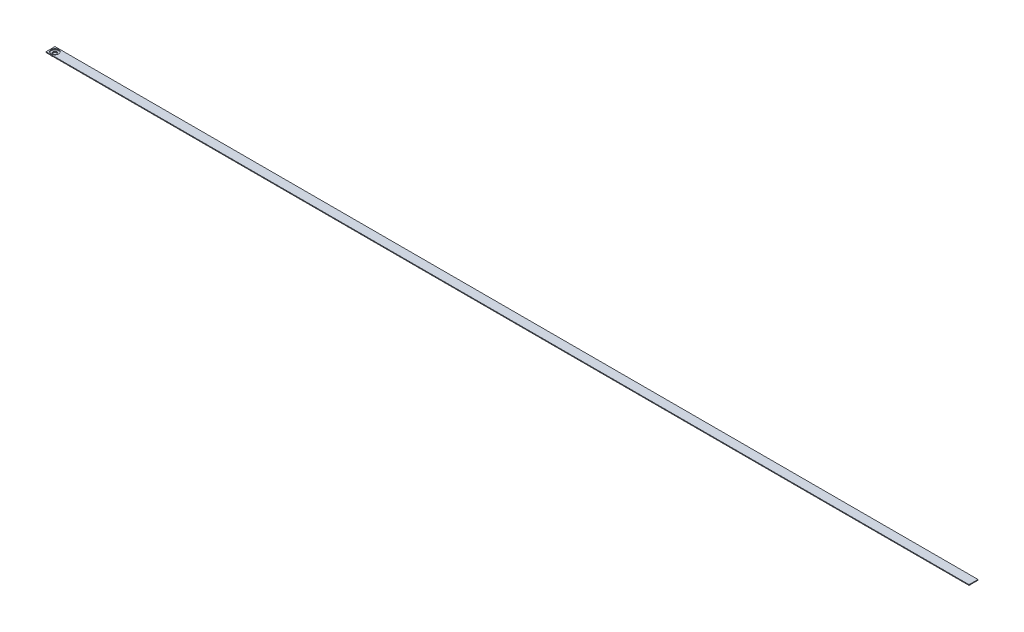
from build123d import *

# Parameters (mm, degrees)
SKETCH1_W           = 2450
SKETCH1_H           = 23.8
BOSS_EXTRUDE1_DEPTH = 0.95
CUT_EXTRUDE1_REACH  = 1227.059
SKETCH3_R           = 10
SKETCH4_R           = 10
SKETCH4_R_2         = 5.25
BOSS_EXTRUDE3_DEPTH = 0.95
SKETCH5_R           = 5.25
BOSS_EXTRUDE4_DEPTH = 0.95


with BuildPart() as part:
    # Sketch1 → Boss-Extrude1 (new, symmetric)
    with BuildSketch(Plane(origin=(0, 0, 0), x_dir=(1, 0, 0), z_dir=(0, 1, 0))):
        Rectangle(SKETCH1_W, SKETCH1_H)
    extrude(amount=BOSS_EXTRUDE1_DEPTH, both=True)

    # Sketch3 → Cut-Extrude1 (cut, up to next)
    with BuildSketch(Plane(origin=(0, 0.95, 0), x_dir=(1, 0, 0), z_dir=(0, 1, 0)), mode=Mode.PRIVATE) as cut_extrude1_sk1:
        with Locations(Location((-1213.1, 0, 0), (0, 0, 270))):
            Circle(SKETCH3_R)
    cut_extrude1_tool1 = extrude(cut_extrude1_sk1.sketch, amount=-CUT_EXTRUDE1_REACH, mode=Mode.PRIVATE) & part.part
    add(cut_extrude1_tool1.solids().sort_by_distance((-1213.1, 0.95, 0))[0], mode=Mode.SUBTRACT)


with BuildPart() as body_2:
    # Sketch4 → Boss-Extrude3 (new, symmetric)
    with BuildSketch(Plane(origin=(0, -2.8, 0), x_dir=(1, 0, 0), z_dir=(0, 1, 0))):
        with Locations(Location((-1213.1, 0, 0), (0, 0, 90))):
            Circle(SKETCH4_R)
        with Locations(Location((-1213.1, 0, 0), (0, 0, 90))):
            Circle(SKETCH4_R_2, mode=Mode.SUBTRACT)
    extrude(amount=BOSS_EXTRUDE3_DEPTH, both=True)


with BuildPart() as body_3:
    # Sketch5 → Boss-Extrude4 (new, symmetric)
    with BuildSketch(Plane(origin=(0, -5.6, 0), x_dir=(1, 0, 0), z_dir=(0, 1, 0))):
        with Locations(Location((-1213.1, 0, 0), (0, 0, 90))):
            Circle(SKETCH5_R)
    extrude(amount=BOSS_EXTRUDE4_DEPTH, both=True)


solid = Compound([part.part, body_2.part, body_3.part])
